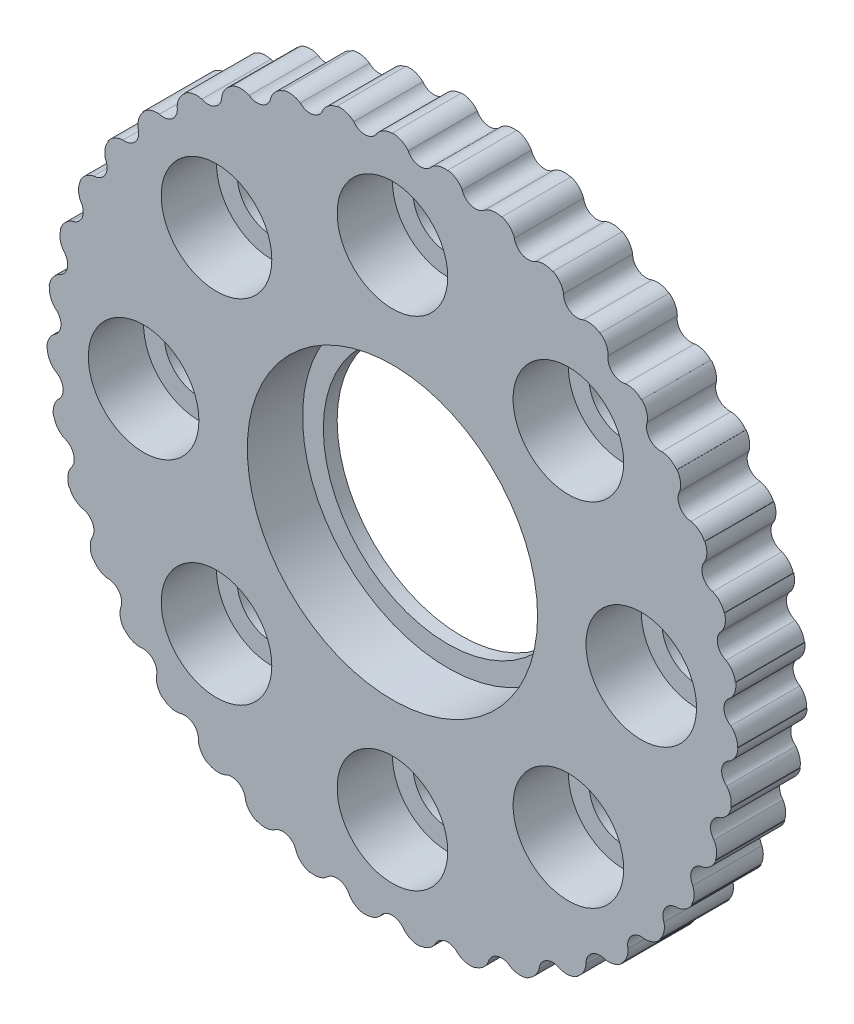
from build123d import *

# Parameters (mm, degrees)
BOSS_EXTRU_1_DEPTH           = 5
R_P_TITION_CIRCULAIRE1_COUNT = 39
ESQUISSE2_R                  = 4
ESQUISSE2_R_2                = 9.5
ENL_V_MAT_EXTRU_1_DEPTH      = 4
ESQUISSE5_R                  = 10.5
ENL_V_MAT_EXTRU_2_DEPTH      = 4
ESQUISSE6_R                  = 2.5
ESQUISSE6_R_2                = 9
ENL_V_MAT_EXTRU_3_DEPTH      = 36.595570443


with BuildPart() as part:
    # Esquisse1 → Boss.-Extru.1 (new body)
    with BuildSketch(Plane.XY):
        with BuildLine():
            Line((0, 25.02), (0, 0))
            Line((0, 0), (5.014186042, 23.95817368))
            ThreePointArc((5.014186042, 23.95817368), (4.003376268, 24.662026737), (2.823950163, 24.306921702))
            ThreePointArc((2.823950163, 24.306921702), (1.936687403, 23.921832984), (1.13843981, 24.468028284))
            ThreePointArc((1.13843981, 24.468028284), (0.632597419, 24.874730051), (0, 25.02))
        make_face()
    boss_extru_1 = extrude(amount=BOSS_EXTRU_1_DEPTH)

    # Répétition circulaire1: Boss.-Extru.1 ×39 about axis
    r_p_tition_circulaire1_axis = Axis((0, 0, 0), (0, 0, 1))
    for i in range(1, R_P_TITION_CIRCULAIRE1_COUNT):
        add(boss_extru_1.rotate(r_p_tition_circulaire1_axis, i * 360 / R_P_TITION_CIRCULAIRE1_COUNT))

    # Esquisse2 → Enlèv. mat.-Extru.1 (cut)
    with BuildSketch(Plane.XY.offset(5)):
        with Locations((0, 18)):
            Circle(ESQUISSE2_R)
        Circle(ESQUISSE2_R_2)
        with Locations((12.727922061, 12.727922061)):
            Circle(ESQUISSE2_R)
        with Locations((18, 0)):
            Circle(ESQUISSE2_R)
        with Locations((12.727922061, -12.727922061)):
            Circle(ESQUISSE2_R)
        with Locations((0, -18)):
            Circle(ESQUISSE2_R)
        with Locations((-12.727922061, -12.727922061)):
            Circle(ESQUISSE2_R)
        with Locations((-18, 0)):
            Circle(ESQUISSE2_R)
        with Locations((-12.727922061, 12.727922061)):
            Circle(ESQUISSE2_R)
    extrude(amount=-ENL_V_MAT_EXTRU_1_DEPTH, mode=Mode.SUBTRACT)

    # Esquisse5 → Enlèv. mat.-Extru.2 (cut)
    with BuildSketch(Plane.XY.offset(5)):
        Circle(ESQUISSE5_R)
    extrude(amount=-ENL_V_MAT_EXTRU_2_DEPTH, mode=Mode.SUBTRACT)

    # Esquisse6 → Enlèv. mat.-Extru.3 (cut, through all)
    with BuildSketch(Plane.XY.offset(1)):
        with Locations((0, 18)):
            Circle(ESQUISSE6_R)
        Circle(ESQUISSE6_R_2)
        with Locations((12.727922061, 12.727922061)):
            Circle(ESQUISSE6_R)
        with Locations((18, 0)):
            Circle(ESQUISSE6_R)
        with Locations((12.727922061, -12.727922061)):
            Circle(ESQUISSE6_R)
        with Locations((0, -18)):
            Circle(ESQUISSE6_R)
        with Locations((-12.727922061, -12.727922061)):
            Circle(ESQUISSE6_R)
        with Locations((-18, 0)):
            Circle(ESQUISSE6_R)
        with Locations((-12.727922061, 12.727922061)):
            Circle(ESQUISSE6_R)
    extrude(amount=-ENL_V_MAT_EXTRU_3_DEPTH, mode=Mode.SUBTRACT)


solid = part.part
